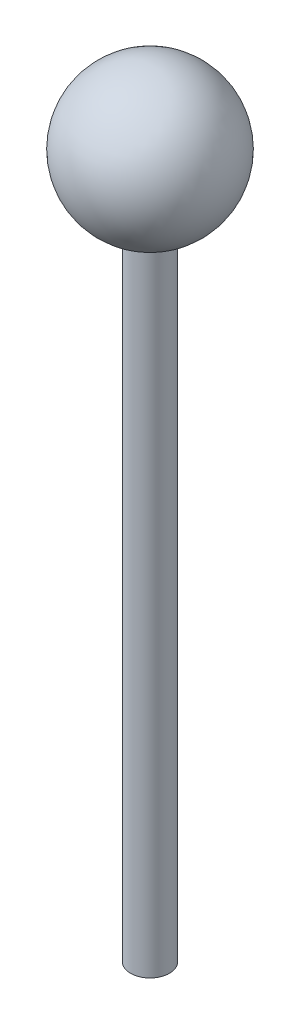
from build123d import *
from build123d.topology import SkipClean

# Parameters (mm, degrees)
SKETCH1_R           = 2
BOSS_EXTRUDE1_DEPTH = 65


with BuildPart() as part:
    # Sketch1 → Boss-Extrude1 (new body)
    with BuildSketch(Plane(origin=(0, 0, 0), x_dir=(1, 0, 0), z_dir=(0, 1, 0))):
        with Locations(Location((0, 0, 0), (0, 0, 270))):
            Circle(SKETCH1_R)
    extrude(amount=BOSS_EXTRUDE1_DEPTH)

    # Sketch2 → Revolve2 (revolve)
    with SkipClean():  # the faces are left unmerged after this step: merging them gives an invalid solid
        with BuildSketch(Plane.XY, mode=Mode.PRIVATE) as revolve2_sk:
            with BuildLine():
                ThreePointArc((7.5, 72.228416147), (5.303300859, 77.531717006), (0, 79.728416147))
                Line((0, 79.728416147), (0, 64.728416147))
                ThreePointArc((0, 64.728416147), (5.303300859, 66.925115289), (7.5, 72.228416147))
            make_face()
            with BuildLine():
                Line((0, 64.728416147), (0, 79.728416147))
                ThreePointArc((0, 79.728416147), (-7.5, 72.228416147), (0, 64.728416147))
            make_face()
        revolve(revolve2_sk.sketch.rotate(Axis((0, 65, 0), (0, 1, 0)), 180), axis=Axis((0, 65, 0), (0, 1, 0)))


solid = part.part
